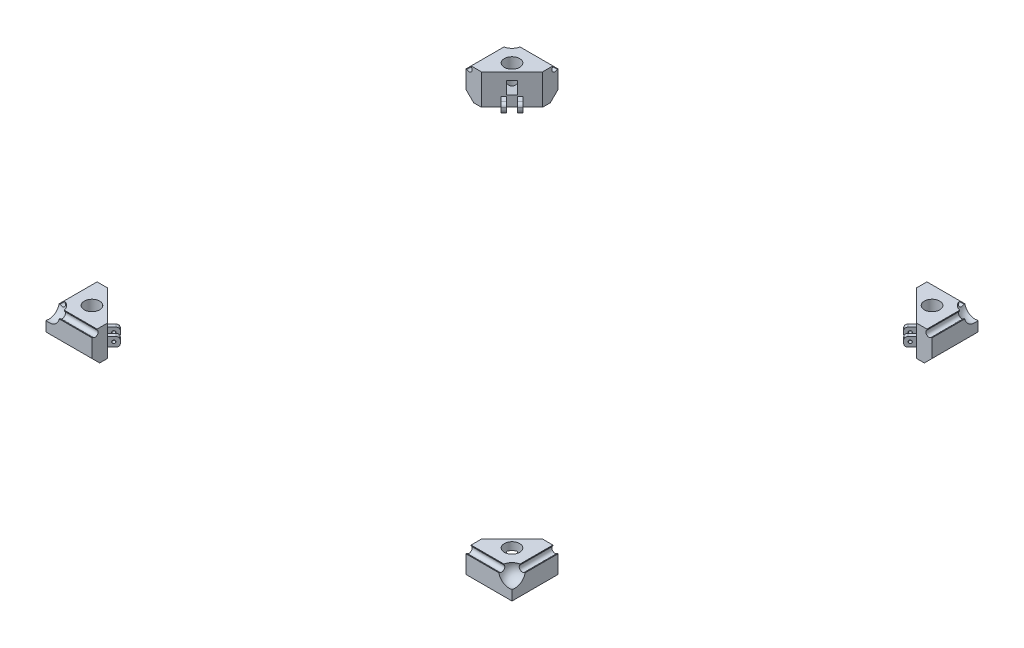
from build123d import *

# Parameters (mm, degrees)
SKETCH_1_R               = 5
EXTRUDE_1_DEPTH          = 20
CUT_EXTRUDE_1_DEPTH      = 47.904157598
CHAMFER_1_SIZE           = 5
CUT_EXTRUDE_2_DEPTH      = 2.5
SKETCH_6_R               = 1
EXTRUDE_2_DEPTH          = 5
CUT_EXTRUDE_3_DEPTH      = 47.024000792
CUT_EXTRUDE_3_DEPTH_BACK = 47.024000792


with BuildPart() as part:
    # 草圖1 → 填料-伸長1 (new body)
    with BuildSketch(Plane(origin=(0, 0, 0), x_dir=(1, 0, 0), z_dir=(0, 1, 0))):
        Polygon((0, 0), (0, -30), (10, -30), (30, -10), (30, 0), align=None)
        with Locations(Location((15, -15, 0), (0, 0, 270))):
            Circle(SKETCH_1_R, mode=Mode.SUBTRACT)
    extrude(amount=EXTRUDE_1_DEPTH)

    # 草圖2 → 除料-伸長1 (cut, through all)
    with BuildSketch(Plane(origin=(0, 0, 0), x_dir=(-1, 0, 0), z_dir=(0, 0, -1))):
        with BuildLine():
            Line((-3.322875656, 19.5), (-3.322875656, 20))
            Line((-3.322875656, 20), (0, 20))
            Line((0, 20), (0, 16.677124344))
            Line((0, 16.677124344), (-0.5, 16.677124344))
            ThreePointArc((-0.5, 16.677124344), (-3.414213562, 16.585786438), (-3.322875656, 19.5))
        make_face()
    cut_extrude_1 = extrude(amount=-CUT_EXTRUDE_1_DEPTH, mode=Mode.SUBTRACT)

    # 鏡射1: 除料-伸長1 across plane
    add(cut_extrude_1.mirror(Plane(origin=(0, 0, 0), x_dir=(0.7071067811865478, 0, 0.7071067811865472), z_dir=(-0.7071067811865475, 0, 0.7071067811865477))), mode=Mode.SUBTRACT)

    # 草圖3 → 除料-旋轉1 (revolve, cut)
    with BuildSketch(Plane(origin=(0, 18, 0), x_dir=(1, 0, 0), z_dir=(0, 1, 0))):
        with BuildLine():
            Line((9, -2), (-5, -2))
            ThreePointArc((-5, -2), (2, 5), (9, -2))
        make_face()
    revolve(axis=Axis((9, 18, 2), (-1, 0, 0)), mode=Mode.SUBTRACT)

    # 導角1
    chamfer_1_edges = [part.edges().sort_by_distance(p)[0] for p in [
        (0, 0, 15),
        (15, 0, 0),
    ]]
    chamfer(chamfer_1_edges, length=CHAMFER_1_SIZE)

    # 草圖5 → 除料-伸長2 (cut, symmetric)
    with BuildSketch(Plane(origin=(0, 0, 0), x_dir=(0.7071067811865477, 0, 0.7071067811865475), z_dir=(-0.7071067811865475, 0, 0.7071067811865477))):
        Polygon((25.284271247, 15), (28.284271247, 15), (28.284271247, 7), (25.284271247, 12), align=None)
    extrude(amount=CUT_EXTRUDE_2_DEPTH, both=True, mode=Mode.SUBTRACT)

    # 草圖6 → 填料-伸長2 (add, symmetric)
    with BuildSketch(Plane(origin=(0, 0, 0), x_dir=(0.7071067811865477, 0, 0.7071067811865475), z_dir=(-0.7071067811865475, 0, 0.7071067811865477))):
        with BuildLine():
            Line((28.284271247, 0), (32.284271247, 0))
            ThreePointArc((32.284271247, 0), (33.69848481, 0.585786438), (34.284271247, 2))
            Line((34.284271247, 2), (34.284271247, 4))
            ThreePointArc((34.284271247, 4), (33.69848481, 5.414213562), (32.284271247, 6))
            Line((32.284271247, 6), (28.284271247, 6))
            Line((28.284271247, 6), (28.284271247, 0))
        make_face()
        with Locations((31.284271247, 3)):
            Circle(SKETCH_6_R, mode=Mode.SUBTRACT)
    extrude(amount=EXTRUDE_2_DEPTH, both=True)

    # 草圖7 → 除料-伸長3 (cut, two sides: drawn at the far end of the back side and taken through both)
    with BuildSketch(Plane(origin=(0, 6, 0), x_dir=(1, 0, 0), z_dir=(0, 1, 0)).offset(-CUT_EXTRUDE_3_DEPTH_BACK)):
        Polygon((22.474873734, -26.01040764), (18.232233047, -21.767766953), (21.767766953, -18.232233047), (26.01040764, -22.474873734), align=None)
    extrude(amount=CUT_EXTRUDE_3_DEPTH + CUT_EXTRUDE_3_DEPTH_BACK, mode=Mode.SUBTRACT)


with BuildPart() as body_2:
    # 鏡射3: mirrored copy
    add(part.part.mirror(Plane(origin=(152, 0, 0), x_dir=(0, 0, 1), z_dir=(1, 0, 0))))


with BuildPart() as body_3:
    # 鏡射4: mirrored copy
    add(body_2.part.mirror(Plane.XY.offset(152)))


with BuildPart() as body_4:
    # Mirror 4 2: mirrored copy
    add(part.part.mirror(Plane.XY.offset(152)))


solid = Compound([part.part, body_2.part, body_3.part, body_4.part])
